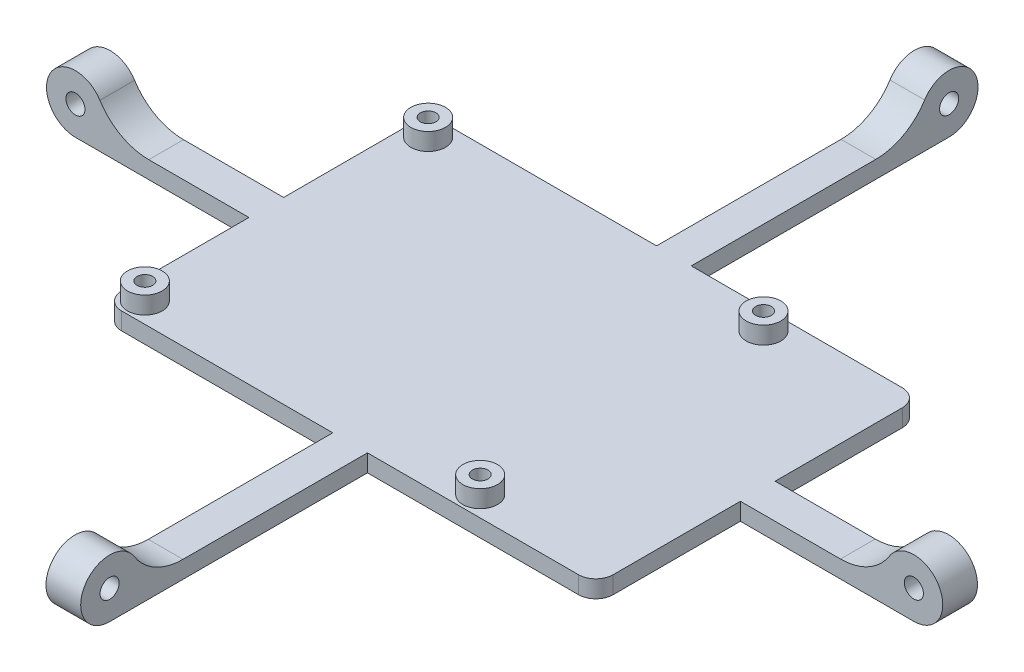
from build123d import *

# Parameters (mm, degrees)
SKETCH1_R                = 1.35
BOSS_EXTRUDE1_DEPTH      = 3
BOSS_EXTRUDE3_DEPTH      = 3
SKETCH2_R                = 3
SKETCH2_R_2              = 1.35
BOSS_EXTRUDE2_DEPTH      = 3
SKETCH4_R                = 5
SKETCH4_R_2              = 1.65
BOSS_EXTRUDE4_DEPTH      = 6
FILLET1_R                = 10
SKETCH6_R                = 5
SKETCH6_R_2              = 1.65
BOSS_EXTRUDE5_DEPTH      = 6
FILLET2_R                = 10
CIRPATTERN4_COUNT        = 2
FILLET1_OF_CIRPATTERN4_R = 10
FILLET2_OF_MIRROR1_R     = 10


with BuildPart() as part:
    # Sketch1 → Boss-Extrude1 (new body)
    with BuildSketch(Plane(origin=(0, 0, 0), x_dir=(1, 0, 0), z_dir=(0, 1, 0))):
        with BuildLine():
            Line((-39.5, -28), (39.5, -28))
            ThreePointArc((39.5, -28), (41.621320344, -27.121320344), (42.5, -25))
            Line((42.5, -25), (42.5, 25))
            ThreePointArc((42.5, 25), (41.621320344, 27.121320344), (39.5, 28))
            Line((39.5, 28), (-39.5, 28))
            ThreePointArc((-39.5, 28), (-41.621320344, 27.121320344), (-42.5, 25))
            Line((-42.5, 25), (-42.5, -25))
            ThreePointArc((-42.5, -25), (-41.621320344, -27.121320344), (-39.5, -28))
        make_face()
        with Locations(Location((-39, -24.5, 0), (0, 0, 270))):
            Circle(SKETCH1_R, mode=Mode.SUBTRACT)
        with Locations(Location((-39, 24.5, 0), (0, 0, 270))):
            Circle(SKETCH1_R, mode=Mode.SUBTRACT)
        with Locations(Location((19, 24.5, 0), (0, 0, 270))):
            Circle(SKETCH1_R, mode=Mode.SUBTRACT)
        with Locations(Location((19, -24.5, 0), (0, 0, 270))):
            Circle(SKETCH1_R, mode=Mode.SUBTRACT)
    extrude(amount=BOSS_EXTRUDE1_DEPTH)

    # Sketch3 → Boss-Extrude3 (add)
    with BuildSketch(Plane(origin=(0, 3, 0), x_dir=(1, 0, 0), z_dir=(0, 1, 0))):
        Polygon((-3, 3), (-72.5, 3), (-72.5, -3), (-3, -3), (-3, -72.5), (3, -72.5), (3, -3), (72.5, -3), (72.5, 3), (3, 3), (3, 72.5), (-3, 72.5), align=None)
    boss_extrude3 = extrude(amount=-BOSS_EXTRUDE3_DEPTH)

    # Sketch2 → Boss-Extrude2 (add)
    # profile 1 of 4: a face of its own
    with BuildSketch(Plane(origin=(0, 3, 0), x_dir=(1, 0, 0), z_dir=(0, 1, 0))):
        with Locations(Location((-39, -24.5, 0), (0, 0, 90))):
            Circle(SKETCH2_R)
        with Locations(Location((-39, -24.5, 0), (0, 0, 270))):
            Circle(SKETCH2_R_2, mode=Mode.SUBTRACT)
    # profile 2 of 4: a face of its own
    with BuildSketch(Plane(origin=(0, 3, 0), x_dir=(1, 0, 0), z_dir=(0, 1, 0))):
        with Locations(Location((-39, 24.5, 0), (0, 0, 90))):
            Circle(SKETCH2_R)
        with Locations(Location((-39, 24.5, 0), (0, 0, 270))):
            Circle(SKETCH2_R_2, mode=Mode.SUBTRACT)
    # profile 3 of 4: a face of its own
    with BuildSketch(Plane(origin=(0, 3, 0), x_dir=(1, 0, 0), z_dir=(0, 1, 0))):
        with Locations(Location((19, 24.5, 0), (0, 0, 90))):
            Circle(SKETCH2_R)
        with Locations(Location((19, 24.5, 0), (0, 0, 270))):
            Circle(SKETCH2_R_2, mode=Mode.SUBTRACT)
    # profile 4 of 4: a face of its own
    with BuildSketch(Plane(origin=(0, 3, 0), x_dir=(1, 0, 0), z_dir=(0, 1, 0))):
        with Locations(Location((19, -24.5, 0), (0, 0, 90))):
            Circle(SKETCH2_R)
        with Locations(Location((19, -24.5, 0), (0, 0, 270))):
            Circle(SKETCH2_R_2, mode=Mode.SUBTRACT)
    extrude(amount=BOSS_EXTRUDE2_DEPTH)

    # Sketch4 → Boss-Extrude4 (add)
    with BuildSketch(Plane.XY.offset(3)):
        with Locations((-72.5, 5)):
            Circle(SKETCH4_R)
        with Locations((-72.5, 5)):
            Circle(SKETCH4_R_2, mode=Mode.SUBTRACT)
    boss_extrude4 = extrude(amount=-BOSS_EXTRUDE4_DEPTH)

    # Fillet1
    fillet1_edges = [part.edges().sort_by_distance(p)[0] for p in [
        (-67.917424305, 3, 0),
    ]]
    fillet(fillet1_edges, radius=FILLET1_R)

    # Sketch6 → Boss-Extrude5 (add)
    with BuildSketch(Plane(origin=(3, 0, 0), x_dir=(0, 0, -1), z_dir=(1, 0, 0))):
        with Locations((-72.592807544, 4.999138602)):
            Circle(SKETCH6_R)
        with Locations((-72.592807544, 4.999138602)):
            Circle(SKETCH6_R_2, mode=Mode.SUBTRACT)
    boss_extrude5 = extrude(amount=-BOSS_EXTRUDE5_DEPTH)

    # Fillet2
    fillet2_edges = [part.edges().sort_by_distance(p)[0] for p in [
        (0, 3, 68.009856001),
    ]]
    fillet(fillet2_edges, radius=FILLET2_R)

    # CirPattern4: Boss-Extrude3, Boss-Extrude4 ×2 about axis
    cirpattern4_axis = Axis((0, 0, 0), (0, 1, 0))
    add([boss_extrude3.rotate(cirpattern4_axis, i * 360 / CIRPATTERN4_COUNT) for i in range(1, CIRPATTERN4_COUNT)])
    add([boss_extrude4.rotate(cirpattern4_axis, i * 360 / CIRPATTERN4_COUNT) for i in range(1, CIRPATTERN4_COUNT)])

    # Fillet1 of CirPattern4
    fillet1_of_cirpattern4_edges = [part.edges().sort_by_distance(p)[0] for p in [
        (67.917424305, 3, 0),
    ]]
    fillet(fillet1_of_cirpattern4_edges, radius=FILLET1_OF_CIRPATTERN4_R)

    # Mirror1: Boss-Extrude5 across plane
    add(boss_extrude5.mirror(Plane.XY))

    # Fillet2 of Mirror1
    fillet2_of_mirror1_edges = [part.edges().sort_by_distance(p)[0] for p in [
        (0, 3, -68.009856001),
    ]]
    fillet(fillet2_of_mirror1_edges, radius=FILLET2_OF_MIRROR1_R)


solid = part.part
